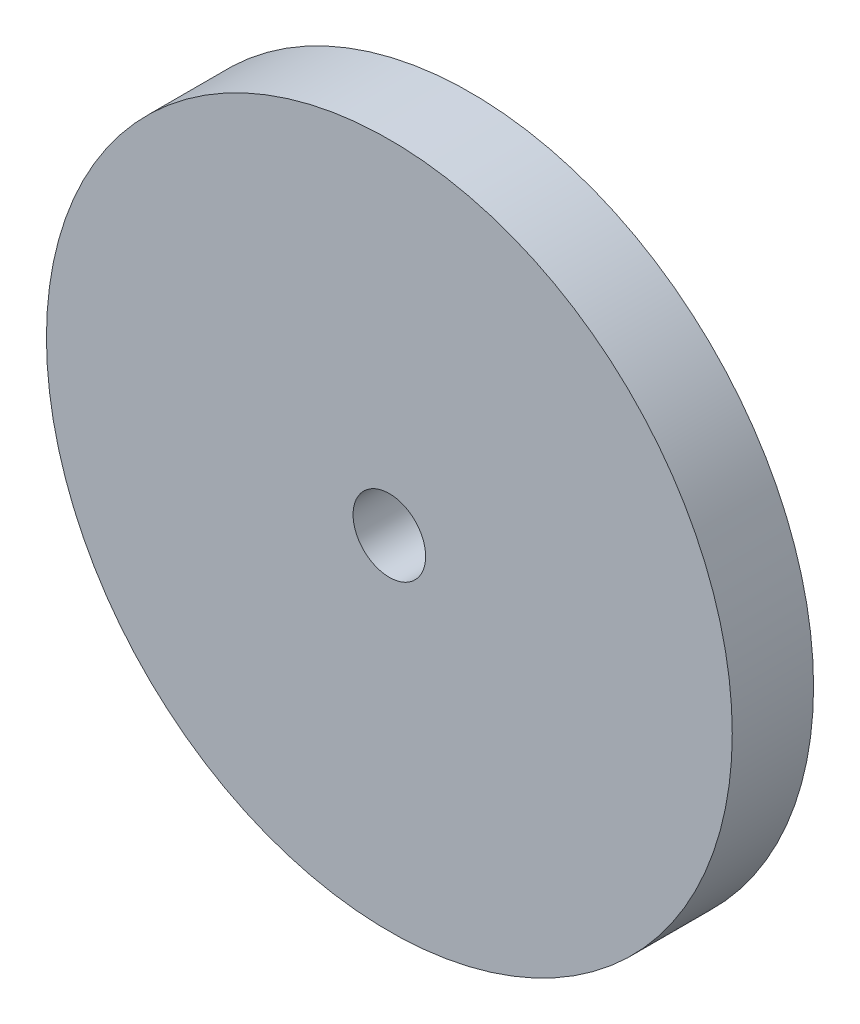
from build123d import *

# Parameters (mm, degrees)
SKETCH1_R                   = 30
BOSS_EXTRUDE1_DEPTH         = 3.556
F_1_4_0_25_DIAMETER_HOLE1_D = 6.35


with BuildPart() as part:
    # Sketch1 → Boss-Extrude1 (new, symmetric)
    with BuildSketch(Plane.XY):
        Circle(SKETCH1_R)
    extrude(amount=BOSS_EXTRUDE1_DEPTH, both=True)

    # 1/4 (0.25) Diameter Hole1 (through all)
    with Locations(Plane.XY.offset(3.556)):
        with Locations((0, 0)):
            Hole(F_1_4_0_25_DIAMETER_HOLE1_D / 2)


solid = part.part
